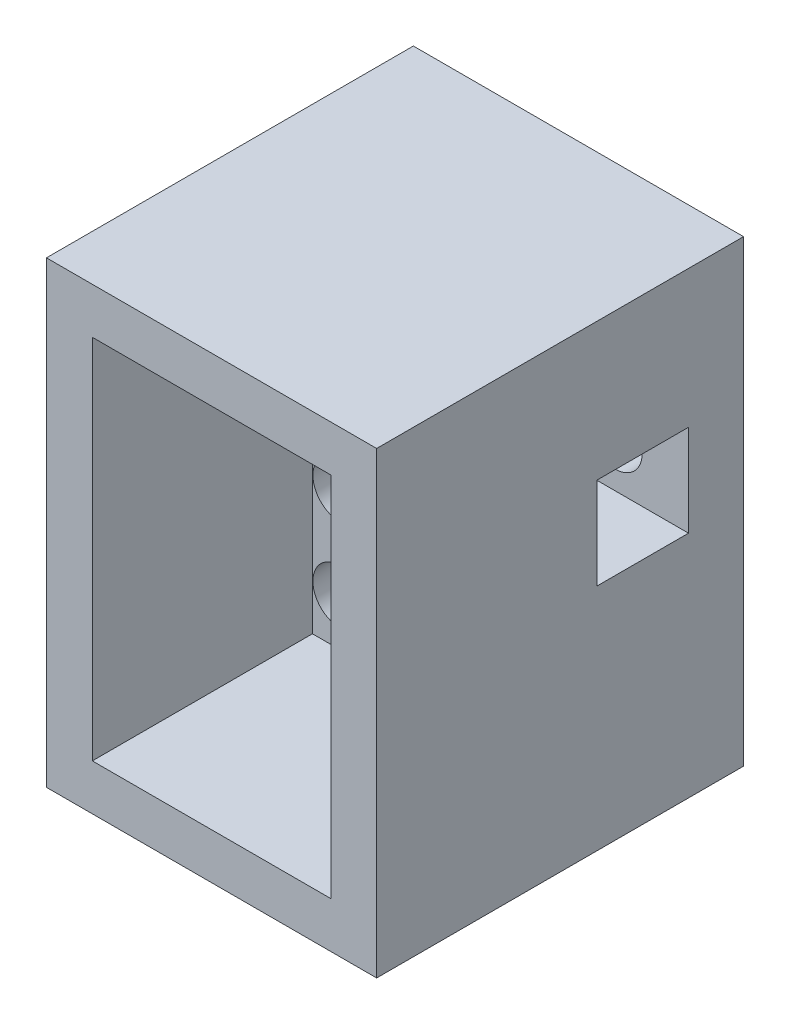
from build123d import *

# Parameters (mm, degrees)
SKETCH1_W            = 25
SKETCH1_H            = 18
BOSS_EXTRUDE1_DEPTH  = 20
SKETCH2_W            = 13
SKETCH2_H            = 20
CUT_EXTRUDE1_DEPTH   = 12
SKETCH5_W            = 5
SKETCH5_H            = 10
CUT_EXTRUDE4_DEPTH   = 8
SKETCH3_R            = 1.475
CUT_EXTRUDE2_DEPTH   = 10
LPATTERN1_COUNT      = 3
LPATTERN1_PITCH      = 5
LPATTERN1_COUNT_DIR2 = 4
LPATTERN1_PITCH_DIR2 = 5
CUT_EXTRUDE3_REACH   = 31.669
SKETCH4_W            = 5
SKETCH4_H            = 5
CHAMFER1_SIZE        = 2


with BuildPart() as part:
    # Sketch1 → Boss-Extrude1 (new body)
    with BuildSketch(Plane(origin=(0, 0, 0), x_dir=(0, 1, 0), z_dir=(0, 0, 1))):
        Rectangle(SKETCH1_W, SKETCH1_H)
    extrude(amount=BOSS_EXTRUDE1_DEPTH)

    # Sketch2 → Cut-Extrude1 (cut)
    with BuildSketch(Plane.XY.offset(20)):
        Rectangle(SKETCH2_W, SKETCH2_H)
    extrude(amount=-CUT_EXTRUDE1_DEPTH, mode=Mode.SUBTRACT)

    # Sketch5 → Cut-Extrude4 (cut)
    with BuildSketch(Plane.XY.offset(8)):
        with Locations((0, 5)):
            Rectangle(SKETCH5_W, SKETCH5_H)
    extrude(amount=-CUT_EXTRUDE4_DEPTH, mode=Mode.SUBTRACT)

    # Sketch3 → Cut-Extrude2 (cut)
    with BuildSketch(Plane(origin=(0, 0, 0), x_dir=(1, 0, 0), z_dir=(0, 0, -1))):
        with Locations(Location((-5, 7.5, 0), (0, 0, 180))):
            Circle(SKETCH3_R)
    cut_extrude2 = extrude(amount=-CUT_EXTRUDE2_DEPTH, mode=Mode.SUBTRACT)

    # LPattern1: Cut-Extrude2 3 × 4, 2 skipped
    with Locations(*[(i * LPATTERN1_PITCH, j * LPATTERN1_PITCH_DIR2, 0) for i in range(LPATTERN1_COUNT) for j in range(LPATTERN1_COUNT_DIR2) if (i, j) not in ((0, 0), (1, 2), (1, 3))]):
        add(cut_extrude2, mode=Mode.SUBTRACT)

    # Cut-Extrude3: up to this face of the body (flat: up to its plane)
    cut_extrude3_end = Plane(part.part.faces().sort_by_distance((2.5, 5, 4))[0])
    # Sketch4 → Cut-Extrude3 (cut, up to the picked face)
    with BuildSketch(Plane.YZ.offset(9), mode=Mode.PRIVATE) as cut_extrude3_sk1:
        with Locations((2.5, 5.5)):
            Rectangle(SKETCH4_W, SKETCH4_H)
    cut_extrude3_tool1 = split(extrude(cut_extrude3_sk1.sketch, amount=-CUT_EXTRUDE3_REACH, mode=Mode.PRIVATE), bisect_by=cut_extrude3_end, keep=Keep.BOTH, mode=Mode.PRIVATE)
    add(cut_extrude3_tool1.solids().sort_by(Axis((9, 2.5, 5.5), (-1, 0, 0)))[0], mode=Mode.SUBTRACT)

    # Chamfer1
    chamfer1_edges = [part.edges().sort_by_distance(p)[0] for p in [
        (2.5, 5, 5.5),
    ]]
    chamfer(chamfer1_edges, length=CHAMFER1_SIZE)


solid = part.part
